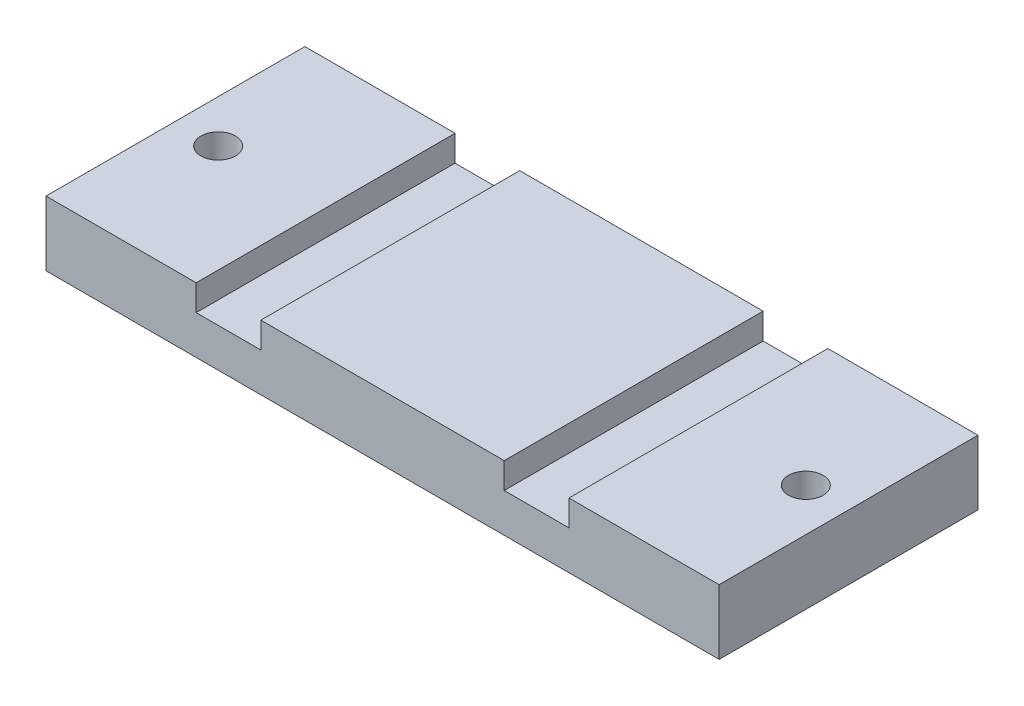
from build123d import *

# Parameters (mm, degrees)
SKETCH1_W            = 66.04
SKETCH1_H            = 25.4
BOSS_EXTRUDE1_DEPTH  = 6.35
M3_CLEARANCE_HOLE1_D = 3.4
SKETCH5_W            = 6.35
SKETCH5_H            = 2.54
CUT_EXTRUDE1_DEPTH   = 72.040580656


with BuildPart() as part:
    # Sketch1 → Boss-Extrude1 (new body)
    with BuildSketch(Plane(origin=(0, 0, 0), x_dir=(1, 0, 0), z_dir=(0, 1, 0))):
        with Locations((33.02, 12.7)):
            Rectangle(SKETCH1_W, SKETCH1_H)
    extrude(amount=BOSS_EXTRUDE1_DEPTH)

    # M3 Clearance Hole1 (through all)
    with Locations(Plane(origin=(0, 6.35, 0), x_dir=(1, 0, 0), z_dir=(0, 1, 0))):
        with Locations((4.191, 12.7), (61.849, 12.7)):
            Hole(M3_CLEARANCE_HOLE1_D / 2)

    # Sketch5 → Cut-Extrude1 (cut, through all)
    with BuildSketch(Plane.XY):
        with Locations((48.133, 5.08)):
            Rectangle(SKETCH5_W, SKETCH5_H)
        with Locations((17.907, 5.08)):
            Rectangle(SKETCH5_W, SKETCH5_H)
    extrude(amount=-CUT_EXTRUDE1_DEPTH, mode=Mode.SUBTRACT)


solid = part.part
